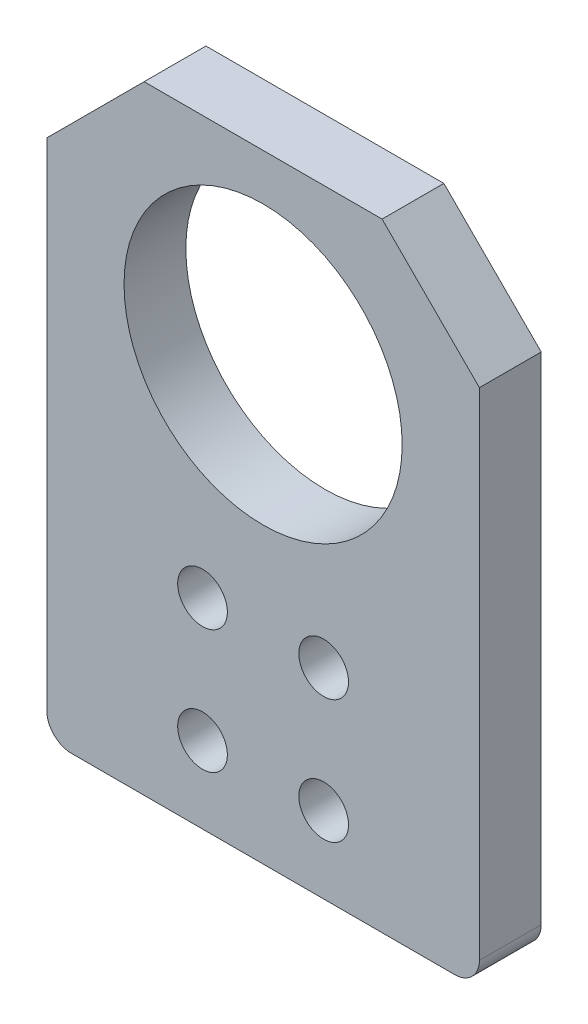
from build123d import *

# Parameters (mm, degrees)
SKETCH1_W                      = 44.45
SKETCH1_H                      = 63.5
BOSS_EXTRUDE1_DEPTH            = 3.175
CHAMFER1_SIZE                  = 10
SKETCH2_R                      = 14.2875
CUT_EXTRUDE1_DEPTH             = 40.272581084
TAP_DRILL_FOR_10_24_TAP1_D     = 3.7973
TAP_DRILL_FOR_10_24_TAP1_DEPTH = 19.05
TAP_DRILL_FOR_10_24_TAP1_TIP   = 1.140824014
F_10_CLEARANCE_HOLE1_D         = 5.1054
F_10_CLEARANCE_HOLE1_DEPTH     = 12.7
F_10_CLEARANCE_HOLE1_TIP       = 1.533816902
FILLET1_R                      = 2.54


with BuildPart() as part:
    # Sketch1 → Boss-Extrude1 (new, symmetric)
    with BuildSketch(Plane.XY):
        Rectangle(SKETCH1_W, SKETCH1_H)
    extrude(amount=BOSS_EXTRUDE1_DEPTH, both=True)

    # Chamfer1
    chamfer1_edges = [part.edges().sort_by_distance(p)[0] for p in [
        (-22.225, 31.75, 0),
        (22.225, 31.75, 0),
    ]]
    chamfer(chamfer1_edges, length=CHAMFER1_SIZE)

    # Sketch2 → Cut-Extrude1 (cut, through all)
    with BuildSketch(Plane.XY.offset(3.175)):
        with Locations((0, 12.7)):
            Circle(SKETCH2_R)
    extrude(amount=-CUT_EXTRUDE1_DEPTH, mode=Mode.SUBTRACT)

    # Tap Drill for #10-24 Tap1
    with Locations(Plane(origin=(0, -31.75, 0), x_dir=(-1, 0, 0), z_dir=(0, -1, 0))):
        with Locations((15.875, 0), (-15.875, 0)):
            Hole(TAP_DRILL_FOR_10_24_TAP1_D / 2, depth=TAP_DRILL_FOR_10_24_TAP1_DEPTH)
            with Locations((0, 0, -(TAP_DRILL_FOR_10_24_TAP1_DEPTH + TAP_DRILL_FOR_10_24_TAP1_TIP / 2))):  # 118° drill point
                Cone(0, TAP_DRILL_FOR_10_24_TAP1_D / 2, TAP_DRILL_FOR_10_24_TAP1_TIP, mode=Mode.SUBTRACT)

    # #10 Clearance Hole1
    with Locations(Plane.XY.offset(3.175)):
        with Locations((-6.223, -11.176), (6.223, -11.176), (6.223, -23.876), (-6.223, -23.876)):
            Hole(F_10_CLEARANCE_HOLE1_D / 2, depth=F_10_CLEARANCE_HOLE1_DEPTH)
            with Locations((0, 0, -(F_10_CLEARANCE_HOLE1_DEPTH + F_10_CLEARANCE_HOLE1_TIP / 2))):  # 118° drill point
                Cone(0, F_10_CLEARANCE_HOLE1_D / 2, F_10_CLEARANCE_HOLE1_TIP, mode=Mode.SUBTRACT)

    # Fillet1
    fillet1_edges = [part.edges().sort_by_distance(p)[0] for p in [
        (22.225, -31.75, 0),
        (-22.225, -31.75, 0),
    ]]
    fillet(fillet1_edges, radius=FILLET1_R)


solid = part.part
